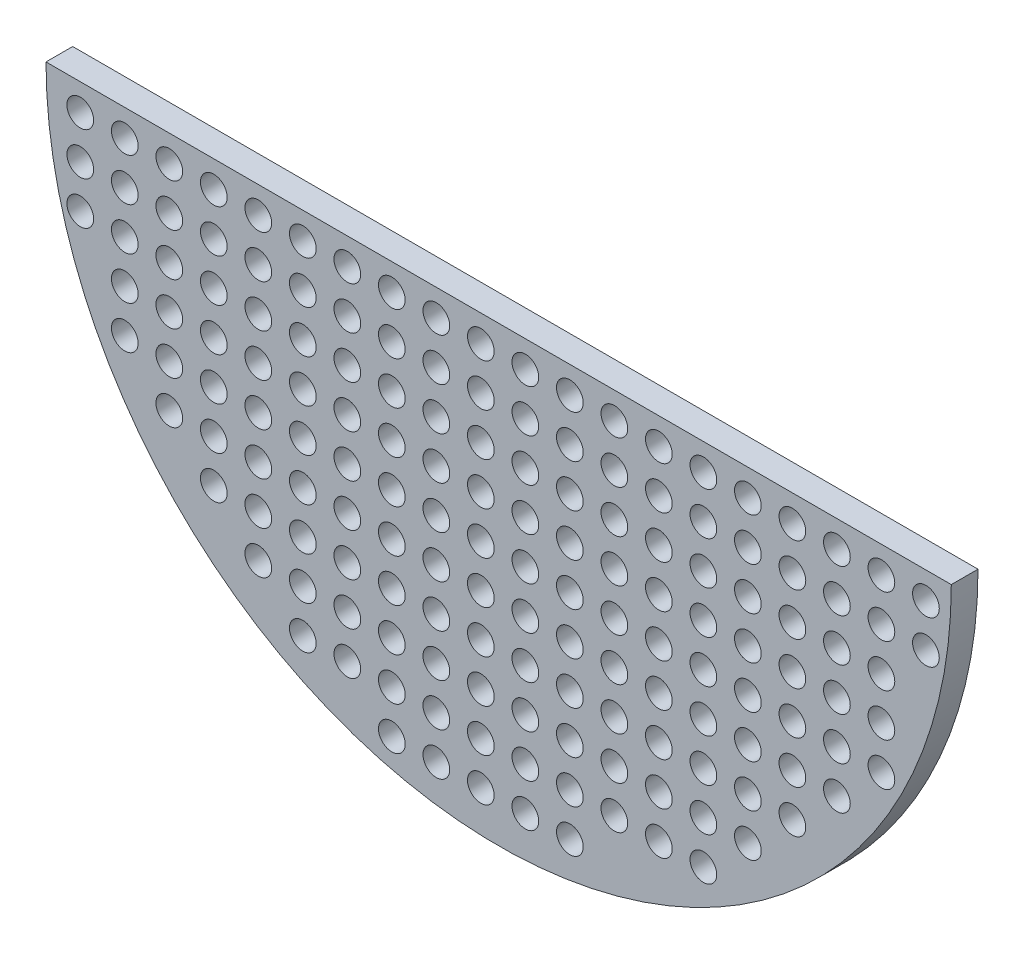
from build123d import *

# Parameters (mm, degrees)
BOSS_EXTRUDE1_DEPTH  = 1.5
SKETCH2_R            = 1.5
CUT_EXTRUDE1_DEPTH   = 72.975308266
LPATTERN1_COUNT      = 20
LPATTERN1_PITCH      = 5
LPATTERN1_COUNT_DIR2 = 10
LPATTERN1_PITCH_DIR2 = 4.8


with BuildPart() as part:
    # Sketch1 → Boss-Extrude1 (new, symmetric)
    with BuildSketch(Plane.XY):
        with BuildLine():
            Line((-50.85, 0), (50.85, 0))
            ThreePointArc((50.85, 0), (0, -50.85), (-50.85, 0))
        make_face()
    extrude(amount=BOSS_EXTRUDE1_DEPTH, both=True)

    # Sketch2 → Cut-Extrude1 (cut, through all)
    with BuildSketch(Plane.XY.offset(1.5)):
        with Locations((-47, -3)):
            Circle(SKETCH2_R)
    cut_extrude1 = extrude(amount=-CUT_EXTRUDE1_DEPTH, mode=Mode.SUBTRACT)

    # LPattern1: Cut-Extrude1 20 × 10, 48 skipped
    with Locations(*[(i * LPATTERN1_PITCH, -j * LPATTERN1_PITCH_DIR2, 0) for i in range(LPATTERN1_COUNT) for j in range(LPATTERN1_COUNT_DIR2) if (i, j) not in ((0, 0), (0, 3), (0, 4), (0, 5), (0, 6), (0, 7), (0, 8), (0, 9), (1, 5), (1, 6), (1, 7), (1, 8), (1, 9), (2, 6), (2, 7), (2, 8), (2, 9), (3, 7), (3, 8), (3, 9), (4, 8), (4, 9), (5, 9), (6, 9), (12, 9), (13, 9), (14, 9), (15, 8), (15, 9), (16, 7), (16, 8), (16, 9), (17, 6), (17, 7), (17, 8), (17, 9), (18, 5), (18, 6), (18, 7), (18, 8), (18, 9), (19, 2), (19, 3), (19, 4), (19, 5), (19, 6), (19, 7), (19, 8), (19, 9))]):
        add(cut_extrude1, mode=Mode.SUBTRACT)


solid = part.part
